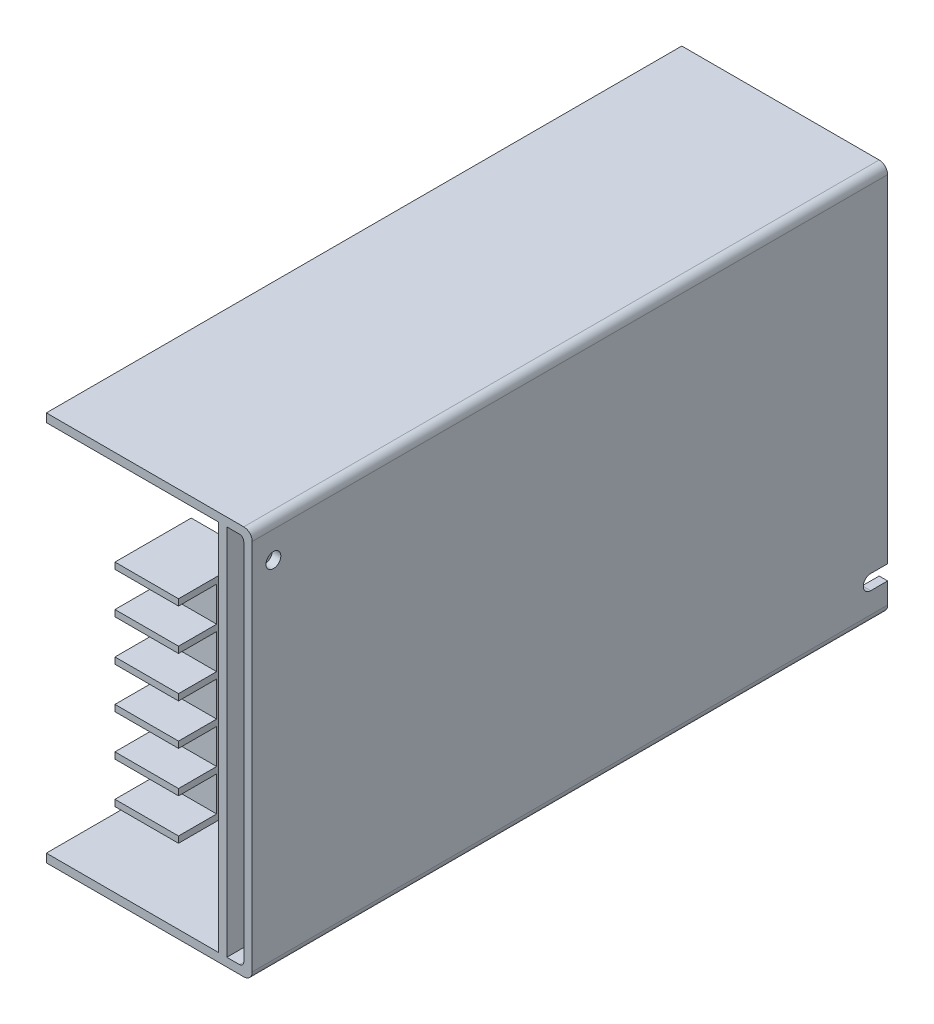
from build123d import *

# Parameters (mm, degrees)
EXTRUDE_1_DEPTH     = 150
SKETCH_2_W          = 2
SKETCH_2_H          = 88
EXTRUDE_2_DEPTH     = 150
SKETCH_3_R          = 15
SKETCH_3_R_2        = 6.5
SKETCH_3_W          = 30
SKETCH_3_H          = 35
EXTRUDE_3_DEPTH     = 38
EXTRUDE_4_DEPTH     = 15
CUT_EXTRUDE_1_REACH = 174.877
SKETCH_5_R          = 1.75
SKETCH_6_R          = 2.5
EXTRUDE_5_DEPTH     = 3
CUT_EXTRUDE_2_REACH = 173.633
SKETCH_7_W          = 9
SKETCH_7_H          = 88


with BuildPart() as part:
    # 草图1 → 凸台-拉伸1 (new body)
    with BuildSketch(Plane.XY):
        with BuildLine():
            Line((-24.3, 44), (21.3, 44))
            ThreePointArc((21.3, 44), (22.007106781, 43.707106781), (22.3, 43))
            Line((22.3, 43), (22.3, -43))
            ThreePointArc((22.3, -43), (22.007106781, -43.707106781), (21.3, -44))
            Line((21.3, -44), (-24.3, -44))
            Line((-24.3, -44), (-24.3, -46))
            Line((-24.3, -46), (22.3, -46))
            ThreePointArc((22.3, -46), (23.714213562, -45.414213562), (24.3, -44))
            Line((24.3, -44), (24.3, 44))
            ThreePointArc((24.3, 44), (23.714213562, 45.414213562), (22.3, 46))
            Line((22.3, 46), (-24.3, 46))
            Line((-24.3, 46), (-24.3, 44))
        make_face()
    extrude(amount=EXTRUDE_1_DEPTH)

    # 草图2 → 凸台-拉伸2 (add)
    with BuildSketch(Plane(origin=(0, 0, 0), x_dir=(-1, 0, 0), z_dir=(0, 0, -1))):
        with Locations((-17.3, 0)):
            Rectangle(SKETCH_2_W, SKETCH_2_H)
    extrude(amount=-EXTRUDE_2_DEPTH)

    # 草图3 → 凸台-拉伸3 (add)
    with BuildSketch(Plane.ZY.offset(-16.3)):
        with Locations(Location((27.5, 20.5, 0), (0, 0, 270))):
            Circle(SKETCH_3_R)
        with Locations(Location((27.5, -13.5, 0), (0, 0, 270))):
            Circle(SKETCH_3_R)
        with Locations(Location((108.160228903, -12.5, 0), (0, 0, 270))):
            Circle(SKETCH_3_R_2)
        with Locations(Location((121.5, -15.5, 0), (0, 0, 270))):
            Circle(SKETCH_3_R_2)
        with Locations((81, -22.5)):
            Rectangle(SKETCH_3_W, SKETCH_3_H)
        Polygon((52.497113206, 30.367528908), (72.528628507, 30.367528908), (72.528628507, 27.598945493), (65.398687695, 27.598945493), (65.398687695, 22.22463651), (72.528628507, 22.22463651), (72.528628507, 19.456053094), (65.398687695, 19.456053094), (65.398687695, 15.547464743), (72.528628507, 15.547464743), (72.528628507, 13.756028415), (65.398687695, 13.756028415), (65.398687695, 9.196008671), (72.528628507, 9.196008671), (72.528628507, 7.241714496), (52.497113206, 7.241714496), (52.497113206, 9.196008671), (62.512870856, 9.196008671), (62.512870856, 27.598945493), (52.497113206, 27.598945493), align=None)
    extrude(amount=EXTRUDE_3_DEPTH)

    # 草图4 → 凸台-拉伸4 (add)
    with BuildSketch(Plane.ZY.offset(-16.3)):
        Polygon((159.4, 33), (141.4, 33), (141.4, -17), (159.4, -17), (159.4, -15.5), (150.4, -15.5), (150.4, -7.3), (159.4, -7.3), (159.4, -5.8), (150.4, -5.8), (150.4, 2.4), (159.4, 2.4), (159.4, 3.9), (150.4, 3.9), (150.4, 12.1), (159.4, 12.1), (159.4, 13.6), (150.4, 13.6), (150.4, 21.8), (159.4, 21.8), (159.4, 23.3), (150.4, 23.3), (150.4, 31.5), (159.4, 31.5), align=None)
    extrude(amount=EXTRUDE_4_DEPTH)

    # 草图5 → 切除-拉伸1 (cut, up to next)
    with BuildSketch(Plane(origin=(24.3, 0, 0), x_dir=(0, 0, -1), z_dir=(1, 0, 0)), mode=Mode.PRIVATE) as cut_extrude_1_sk1:
        with Locations(Location((-145, 37.7, 0), (0, 0, 90))):
            Circle(SKETCH_5_R)
    cut_extrude_1_tool1 = extrude(cut_extrude_1_sk1.sketch, amount=-CUT_EXTRUDE_1_REACH, mode=Mode.PRIVATE) & part.part
    # 草图5 → 切除-拉伸1 (cut, up to next)
    with BuildSketch(Plane(origin=(24.3, 0, 0), x_dir=(0, 0, -1), z_dir=(1, 0, 0)), mode=Mode.PRIVATE) as cut_extrude_1_sk2:
        with BuildLine():
            Line((-4, -35.55), (0, -35.55))
            Line((0, -35.55), (0, -39.05))
            Line((0, -39.05), (-4, -39.05))
            ThreePointArc((-4, -39.05), (-5.75, -37.3), (-4, -35.55))
        make_face()
    cut_extrude_1_tool2 = extrude(cut_extrude_1_sk2.sketch, amount=-CUT_EXTRUDE_1_REACH, mode=Mode.PRIVATE) & part.part
    add(cut_extrude_1_tool1.solids().sort_by_distance((24.3, 37.7, 145))[0], mode=Mode.SUBTRACT)
    add(cut_extrude_1_tool2.solids().sort_by_distance((24.3, -37.3, 2.701417))[0], mode=Mode.SUBTRACT)

    # 草图6 → 凸台-拉伸5 (add)
    with BuildSketch(Plane.XZ.offset(46)):
        with Locations(Location((-4.3, 118, 0), (0, 0, 180))):
            Circle(SKETCH_6_R)
        with Locations(Location((-4.3, 59, 0), (0, 0, 180))):
            Circle(SKETCH_6_R)
        with Locations(Location((-4.3, 24, 0), (0, 0, 180))):
            Circle(SKETCH_6_R)
    extrude(amount=EXTRUDE_5_DEPTH)

    # 草图7 → 切除-拉伸2 (cut, up to next)
    with BuildSketch(Plane.ZY.offset(-16.3), mode=Mode.PRIVATE) as cut_extrude_2_sk1:
        with Locations((4.5, 0)):
            Rectangle(SKETCH_7_W, SKETCH_7_H)
    cut_extrude_2_tool1 = extrude(cut_extrude_2_sk1.sketch, amount=-CUT_EXTRUDE_2_REACH, mode=Mode.PRIVATE) & part.part
    add(cut_extrude_2_tool1.solids().sort_by_distance((16.3, 0, 4.5))[0], mode=Mode.SUBTRACT)


solid = part.part
